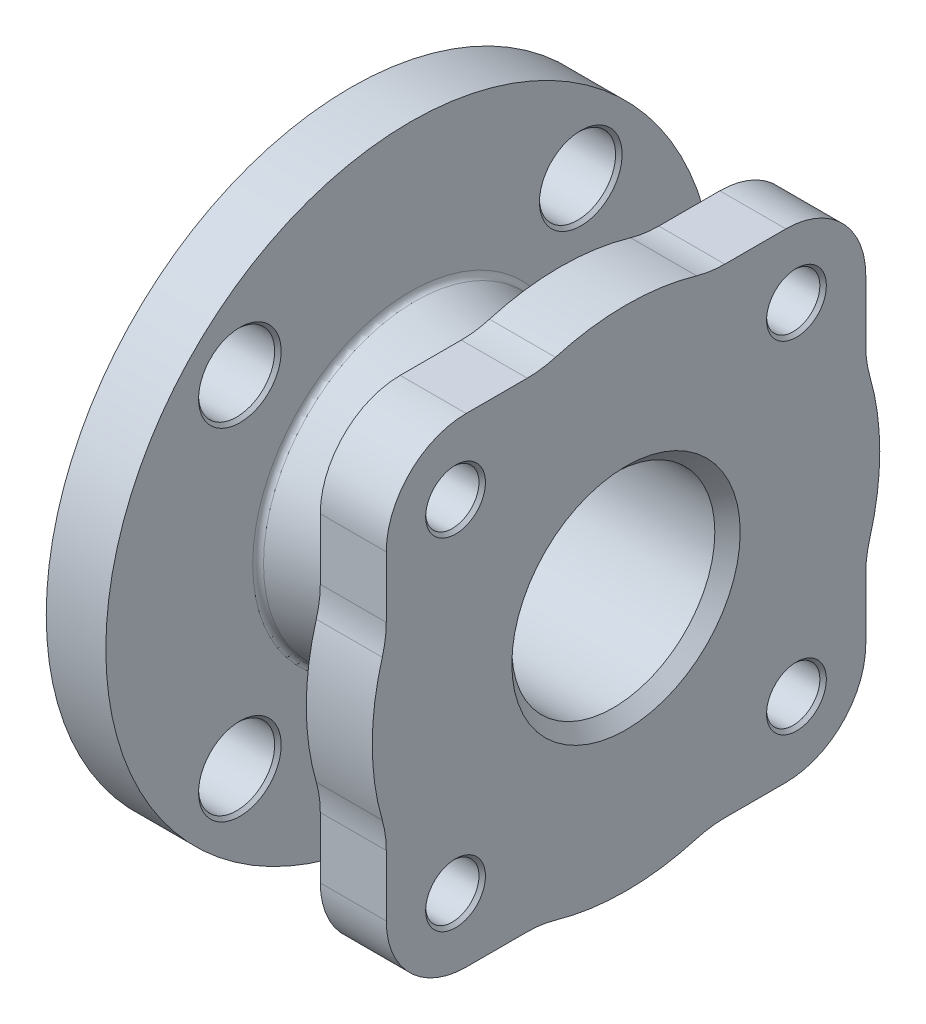
from build123d import *

# Parameters (mm, degrees)
BOSS_EXTRUDE1_START = 16.51
SKETCH2_R           = 6.6675
SKETCH2_R_2         = 47.625
SKETCH2_R_3         = 25.4
BOSS_EXTRUDE1_DEPTH = 16.51
CUT_EXTRUDE1_REACH  = 129.898
SKETCH3_R           = 9.525
CHAMFER1_SIZE       = 0.8128
CHAMFER2_SIZE       = 0.8128
CHAMFER3_SIZE       = 3.175
FILLET2_R           = 1.524


with BuildPart() as part:
    # Sketch1 → Revolve1 (revolve)
    with BuildSketch(Plane.XY, mode=Mode.PRIVATE) as revolve1_sk:
        Polygon((0, 25.4), (53.975, 25.4), (53.975, 47.625), (52.3748, 46.0248), (52.3748, 34.29), (34.925, 34.29), (16.51, 38.204229083), (16.51, 76.2), (1.6002, 76.2), (1.6002, 47.6377), (0, 46.0375), align=None)
    revolve(revolve1_sk.sketch.rotate(Axis((0, 0, 0), (1, 0, 0)), 90), axis=Axis((0, 0, 0), (1, 0, 0)))

    # Sketch2 → Boss-Extrude1 (add)
    # profile 1 of 2: a face of its own
    with BuildSketch(Plane(origin=(53.975, 0, 0), x_dir=(0, 0, -1), z_dir=(1, 0, 0)).offset(BOSS_EXTRUDE1_START)):
        with BuildLine():
            Line((-59.9948, 40.005), (-59.9948, 24.717162721))
            ThreePointArc((-59.9948, 24.717162721), (-60.246417717, 21.150810443), (-60.996285714, 17.655116229))
            ThreePointArc((-60.996285714, 17.655116229), (-63.5, 0), (-60.996285714, -17.655116229))
            ThreePointArc((-60.996285714, -17.655116229), (-60.246417717, -21.150810443), (-59.9948, -24.717162721))
            Line((-59.9948, -24.717162721), (-59.9948, -40.005))
            ThreePointArc((-59.9948, -40.005), (-54.139923135, -54.139923135), (-40.005, -59.9948))
            Line((-40.005, -59.9948), (-24.717162721, -59.9948))
            ThreePointArc((-24.717162721, -59.9948), (-21.150810443, -60.246417717), (-17.655116229, -60.996285714))
            ThreePointArc((-17.655116229, -60.996285714), (0, -63.5), (17.655116229, -60.996285714))
            ThreePointArc((17.655116229, -60.996285714), (21.150810443, -60.246417717), (24.717162721, -59.9948))
            Line((24.717162721, -59.9948), (40.005, -59.9948))
            ThreePointArc((40.005, -59.9948), (54.139923135, -54.139923135), (59.9948, -40.005))
            Line((59.9948, -40.005), (59.9948, -24.717162721))
            ThreePointArc((59.9948, -24.717162721), (60.246417717, -21.150810443), (60.996285714, -17.655116229))
            ThreePointArc((60.996285714, -17.655116229), (63.5, 0), (60.996285714, 17.655116229))
            ThreePointArc((60.996285714, 17.655116229), (60.246417717, 21.150810443), (59.9948, 24.717162721))
            Line((59.9948, 24.717162721), (59.9948, 40.005))
            ThreePointArc((59.9948, 40.005), (54.139923135, 54.139923135), (40.005, 59.9948))
            Line((40.005, 59.9948), (24.717162721, 59.9948))
            ThreePointArc((24.717162721, 59.9948), (21.150810443, 60.246417717), (17.655116229, 60.996285714))
            ThreePointArc((17.655116229, 60.996285714), (0, 63.5), (-17.655116229, 60.996285714))
            ThreePointArc((-17.655116229, 60.996285714), (-21.150810443, 60.246417717), (-24.717162721, 59.9948))
            Line((-24.717162721, 59.9948), (-40.005, 59.9948))
            ThreePointArc((-40.005, 59.9948), (-54.139923135, 54.139923135), (-59.9948, 40.005))
        make_face()
        with Locations((-42.656216575, -42.656216575)):
            Circle(SKETCH2_R, mode=Mode.SUBTRACT)
        with Locations((42.656216575, -42.656216575)):
            Circle(SKETCH2_R, mode=Mode.SUBTRACT)
        with Locations((42.656216575, 42.656216575)):
            Circle(SKETCH2_R, mode=Mode.SUBTRACT)
        with Locations((-42.656216575, 42.656216575)):
            Circle(SKETCH2_R, mode=Mode.SUBTRACT)
        Circle(SKETCH2_R_2, mode=Mode.SUBTRACT)
    # profile 2 of 2: a face of its own
    with BuildSketch(Plane(origin=(53.975, 0, 0), x_dir=(0, 0, -1), z_dir=(1, 0, 0)).offset(BOSS_EXTRUDE1_START)):
        Circle(SKETCH2_R_2)
        with Locations(Location((0, 0, 0), (0, 0, 180))):
            Circle(SKETCH2_R_3, mode=Mode.SUBTRACT)
    extrude(amount=-BOSS_EXTRUDE1_DEPTH)

    # Sketch3 → Cut-Extrude1 (cut, up to next)
    with BuildSketch(Plane.ZY.offset(-1.6002), mode=Mode.PRIVATE) as cut_extrude1_sk1:
        with Locations((-42.656216575, 42.656216575)):
            Circle(SKETCH3_R)
    cut_extrude1_tool1 = extrude(cut_extrude1_sk1.sketch, amount=-CUT_EXTRUDE1_REACH, mode=Mode.PRIVATE) & part.part
    # Sketch3 → Cut-Extrude1 (cut, up to next)
    with BuildSketch(Plane.ZY.offset(-1.6002), mode=Mode.PRIVATE) as cut_extrude1_sk2:
        with Locations((42.656216575, 42.656216575)):
            Circle(SKETCH3_R)
    cut_extrude1_tool2 = extrude(cut_extrude1_sk2.sketch, amount=-CUT_EXTRUDE1_REACH, mode=Mode.PRIVATE) & part.part
    # Sketch3 → Cut-Extrude1 (cut, up to next)
    with BuildSketch(Plane.ZY.offset(-1.6002), mode=Mode.PRIVATE) as cut_extrude1_sk3:
        with Locations((42.656216575, -42.656216575)):
            Circle(SKETCH3_R)
    cut_extrude1_tool3 = extrude(cut_extrude1_sk3.sketch, amount=-CUT_EXTRUDE1_REACH, mode=Mode.PRIVATE) & part.part
    # Sketch3 → Cut-Extrude1 (cut, up to next)
    with BuildSketch(Plane.ZY.offset(-1.6002), mode=Mode.PRIVATE) as cut_extrude1_sk4:
        with Locations((-42.656216575, -42.656216575)):
            Circle(SKETCH3_R)
    cut_extrude1_tool4 = extrude(cut_extrude1_sk4.sketch, amount=-CUT_EXTRUDE1_REACH, mode=Mode.PRIVATE) & part.part
    add(cut_extrude1_tool1.solids().sort_by_distance((1.6002, 42.656217, -42.656217))[0], mode=Mode.SUBTRACT)
    add(cut_extrude1_tool2.solids().sort_by_distance((1.6002, 42.656217, 42.656217))[0], mode=Mode.SUBTRACT)
    add(cut_extrude1_tool3.solids().sort_by_distance((1.6002, -42.656217, 42.656217))[0], mode=Mode.SUBTRACT)
    add(cut_extrude1_tool4.solids().sort_by_distance((1.6002, -42.656217, -42.656217))[0], mode=Mode.SUBTRACT)

    # Chamfer1
    chamfer1_edges = [part.edges().sort_by_distance(p)[0] for p in [
        (70.485, 42.656216575, 49.323716575),
        (70.485, 42.656216575, -35.988716575),
        (70.485, -42.656216575, -35.988716575),
        (70.485, -42.656216575, 49.323716575),
        (53.975, -42.656216575, 49.323716575),
        (53.975, -42.656216575, -35.988716575),
        (53.975, 42.656216575, -35.988716575),
        (53.975, 42.656216575, 49.323716575),
    ]]
    chamfer(chamfer1_edges, length=CHAMFER1_SIZE)

    # Chamfer2
    chamfer2_edges = [part.edges().sort_by_distance(p)[0] for p in [
        (1.6002, -42.656216575, 33.131216575),
        (16.51, -42.656216575, 33.131216575),
        (1.6002, 42.656216575, 33.131216575),
        (16.51, 42.656216575, 33.131216575),
        (1.6002, 42.656216575, -52.181216575),
        (16.51, 42.656216575, -52.181216575),
        (1.6002, -42.656216575, -52.181216575),
        (16.51, -42.656216575, -52.181216575),
    ]]
    chamfer(chamfer2_edges, length=CHAMFER2_SIZE)

    # Chamfer3
    chamfer3_edges = [part.edges().sort_by_distance(p)[0] for p in [
        (0, 0, -25.4),
        (70.485, 0, -25.4),
    ]]
    chamfer(chamfer3_edges, length=CHAMFER3_SIZE)

    # Fillet2
    fillet2_edges = [part.edges().sort_by_distance(p)[0] for p in [
        (16.51, 0, -38.204229083),
        (52.3748, 0, -34.29),
    ]]
    fillet(fillet2_edges, radius=FILLET2_R)


solid = part.part
